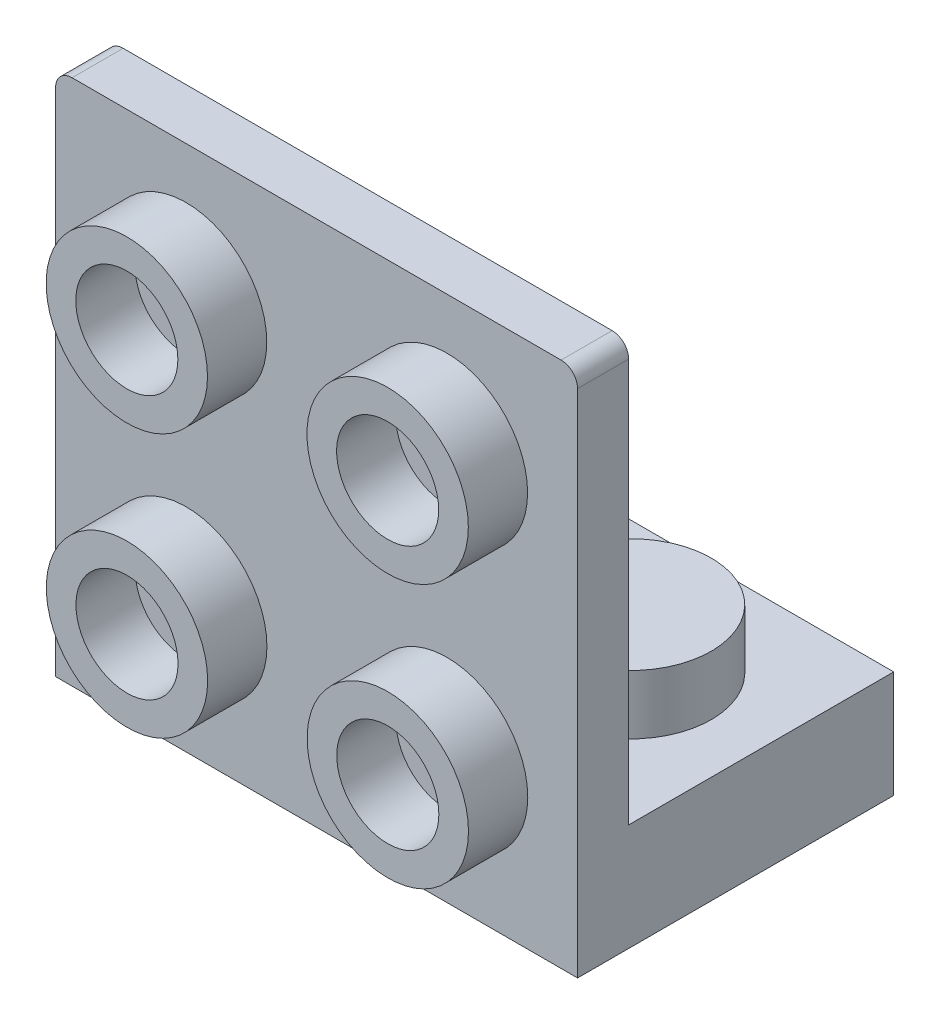
from build123d import *

# Parameters (mm, degrees)
BOSS_EXTRUDE1_DEPTH = 15.85
SKETCH2_R           = 2.45
BOSS_EXTRUDE2_DEPTH = 1.8
SKETCH3_W           = 12.85
SKETCH3_H           = 6.5
CUT_EXTRUDE1_DEPTH  = 2.05
SKETCH4_R           = 0.95
CUT_EXTRUDE2_DEPTH  = 1.5
SKETCH5_R           = 1.5
SKETCH5_R_2         = 0.7
BOSS_EXTRUDE3_DEPTH = 1.85
SKETCH6_R           = 2.45
SKETCH6_R_2         = 1.55
BOSS_EXTRUDE4_DEPTH = 1.8
FILLET1_R           = 0.5


with BuildPart() as part:
    # Sketch1 → Boss-Extrude1 (new body)
    with BuildSketch(Plane(origin=(0, 0, 0), x_dir=(0, 0, -1), z_dir=(1, 0, 0))):
        Polygon((0, 16), (0, 0), (9.6, 0), (9.6, 3.25), (1.55, 3.25), (1.55, 16), align=None)
    extrude(amount=-BOSS_EXTRUDE1_DEPTH)

    # Sketch2 → Boss-Extrude2 (add)
    with BuildSketch(Plane(origin=(0, 3.25, 0), x_dir=(1, 0, 0), z_dir=(0, 1, 0))):
        with Locations(Location((-11.8875, 5.575, 0), (0, 0, 270))):
            Circle(SKETCH2_R)
        with Locations(Location((-3.9625, 5.575, 0), (0, 0, 270))):
            Circle(SKETCH2_R)
    extrude(amount=BOSS_EXTRUDE2_DEPTH)

    # Sketch3 → Cut-Extrude1 (cut)
    with BuildSketch(Plane.XZ):
        with Locations((-7.925, -4.85)):
            Rectangle(SKETCH3_W, SKETCH3_H)
    extrude(amount=-CUT_EXTRUDE1_DEPTH, mode=Mode.SUBTRACT)

    # Sketch4 → Cut-Extrude2 (cut)
    with BuildSketch(Plane.XZ.offset(-2.05)):
        with Locations(Location((-11.8875, -5.575, 0), (0, 0, 270))):
            Circle(SKETCH4_R)
        with Locations(Location((-3.9625, -5.575, 0), (0, 0, 270))):
            Circle(SKETCH4_R)
    extrude(amount=-CUT_EXTRUDE2_DEPTH, mode=Mode.SUBTRACT)

    # Sketch5 → Boss-Extrude3 (add)
    with BuildSketch(Plane.XZ.offset(-2.05)):
        with Locations(Location((-7.925, -5.57, 0), (0, 0, 270))):
            Circle(SKETCH5_R)
        with Locations(Location((-7.925, -5.57, 0), (0, 0, 270))):
            Circle(SKETCH5_R_2, mode=Mode.SUBTRACT)
    extrude(amount=BOSS_EXTRUDE3_DEPTH)

    # Sketch6 → Boss-Extrude4 (add)
    # profile 1 of 4: a face of its own
    with BuildSketch(Plane.XY):
        with Locations((-11.8875, 12)):
            Circle(SKETCH6_R)
        with Locations(Location((-11.8875, 12, 0), (0, 0, 270))):
            Circle(SKETCH6_R_2, mode=Mode.SUBTRACT)
    # profile 2 of 4: a face of its own
    with BuildSketch(Plane.XY):
        with Locations((-3.9675, 12)):
            Circle(SKETCH6_R)
        with Locations(Location((-3.9675, 12, 0), (0, 0, 270))):
            Circle(SKETCH6_R_2, mode=Mode.SUBTRACT)
    # profile 3 of 4: a face of its own
    with BuildSketch(Plane.XY):
        with Locations((-3.9625, 4.000001563)):
            Circle(SKETCH6_R)
        with Locations(Location((-3.9625, 4.000001563, 0), (0, 0, 270))):
            Circle(SKETCH6_R_2, mode=Mode.SUBTRACT)
    # profile 4 of 4: a face of its own
    with BuildSketch(Plane.XY):
        with Locations((-11.8825, 4.000001563)):
            Circle(SKETCH6_R)
        with Locations(Location((-11.8825, 4.000001563, 0), (0, 0, 270))):
            Circle(SKETCH6_R_2, mode=Mode.SUBTRACT)
    extrude(amount=BOSS_EXTRUDE4_DEPTH)

    # Fillet1
    fillet1_edges = [part.edges().sort_by_distance(p)[0] for p in [
        (-15.85, 16, -0.775),
        (0, 16, -0.775),
    ]]
    fillet(fillet1_edges, radius=FILLET1_R)


solid = part.part
